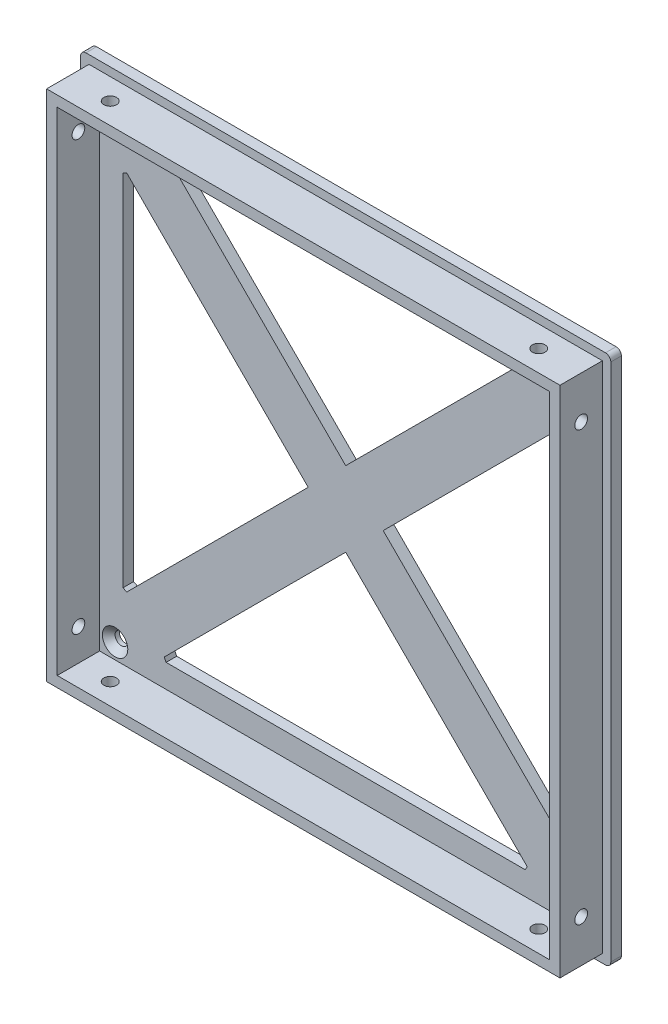
from build123d import *

# Parameters (mm, degrees)
SKETCH1_W                                       = 100
SKETCH1_H                                       = 100
BOSS_EXTRUDE1_DEPTH                             = 2
SKETCH2_W                                       = 96.825
SKETCH2_H                                       = 96.825
SKETCH2_W_2                                     = 92.825
SKETCH2_H_2                                     = 92.825
BOSS_EXTRUDE2_DEPTH                             = 8
CSK_FOR_M2_FLAT_HEAD_MACHINE_SCREW1_D           = 2.4
CSK_FOR_M2_FLAT_HEAD_MACHINE_SCREW1_DEPTH       = 311.5
CSK_FOR_M2_FLAT_HEAD_MACHINE_SCREW1_CSINK_D     = 4.8
CSK_FOR_M2_FLAT_HEAD_MACHINE_SCREW1_CSINK_ANGLE = 90
CSK_FOR_M2_FLAT_HEAD_MACHINE_SCREW1_TIP         = 0.721032743
FILLET1_R                                       = 1
M2_CLEARANCE_HOLE1_D                            = 2.4
M2_CLEARANCE_HOLE2_D                            = 2.4


with BuildPart() as part:
    # Sketch1 → Boss-Extrude1 (new body)
    with BuildSketch(Plane.XY):
        with Locations((50, 50)):
            Rectangle(SKETCH1_W, SKETCH1_H)
        with BuildLine():
            Line((8, 16.124515497), (8, 83.875484503))
            ThreePointArc((8, 83.875484503), (8.347704775, 84.052717317), (8.691485355, 84.237446833))
            Line((8.691485355, 84.237446833), (42.928932188, 50))
            Line((42.928932188, 50), (8.691485355, 15.762553167))
            ThreePointArc((8.691485355, 15.762553167), (8.347704775, 15.947282683), (8, 16.124515497))
        make_face(mode=Mode.SUBTRACT)
        with BuildLine():
            Line((16.124515497, 92), (83.875484503, 92))
            ThreePointArc((83.875484503, 92), (84.052717317, 91.652295225), (84.237446833, 91.308514645))
            Line((84.237446833, 91.308514645), (50, 57.071067812))
            Line((50, 57.071067812), (15.762553167, 91.308514645))
            ThreePointArc((15.762553167, 91.308514645), (15.947282683, 91.652295225), (16.124515497, 92))
        make_face(mode=Mode.SUBTRACT)
        with BuildLine():
            Line((92, 83.875484503), (92, 16.124515497))
            ThreePointArc((92, 16.124515497), (91.652295225, 15.947282683), (91.308514645, 15.762553167))
            Line((91.308514645, 15.762553167), (57.071067812, 50))
            Line((57.071067812, 50), (91.308514645, 84.237446833))
            ThreePointArc((91.308514645, 84.237446833), (91.652295225, 84.052717317), (92, 83.875484503))
        make_face(mode=Mode.SUBTRACT)
        with BuildLine():
            Line((16.124515497, 8), (83.875484503, 8))
            ThreePointArc((83.875484503, 8), (84.052717317, 8.347704775), (84.237446833, 8.691485355))
            Line((84.237446833, 8.691485355), (50, 42.928932188))
            Line((50, 42.928932188), (15.762553167, 8.691485355))
            ThreePointArc((15.762553167, 8.691485355), (15.947282683, 8.347704775), (16.124515497, 8))
        make_face(mode=Mode.SUBTRACT)
    extrude(amount=BOSS_EXTRUDE1_DEPTH)

    # Sketch2 → Boss-Extrude2 (add)
    with BuildSketch(Plane.XY.offset(2)):
        with Locations((50, 50)):
            Rectangle(SKETCH2_W, SKETCH2_H)
        with Locations((50, 50)):
            Rectangle(SKETCH2_W_2, SKETCH2_H_2, mode=Mode.SUBTRACT)
    extrude(amount=BOSS_EXTRUDE2_DEPTH)

    # CSK for M2 Flat Head Machine Screw1
    with Locations(Plane.XY.offset(2)):
        with Locations((6.5, 93.5), (93.5, 93.5), (93.5, 6.5), (6.5, 6.5)):
            CounterSinkHole(CSK_FOR_M2_FLAT_HEAD_MACHINE_SCREW1_D / 2, CSK_FOR_M2_FLAT_HEAD_MACHINE_SCREW1_CSINK_D / 2, depth=CSK_FOR_M2_FLAT_HEAD_MACHINE_SCREW1_DEPTH, counter_sink_angle=CSK_FOR_M2_FLAT_HEAD_MACHINE_SCREW1_CSINK_ANGLE)
            with Locations((0, 0, -(CSK_FOR_M2_FLAT_HEAD_MACHINE_SCREW1_DEPTH + CSK_FOR_M2_FLAT_HEAD_MACHINE_SCREW1_TIP / 2))):  # 118° drill point
                Cone(0, CSK_FOR_M2_FLAT_HEAD_MACHINE_SCREW1_D / 2, CSK_FOR_M2_FLAT_HEAD_MACHINE_SCREW1_TIP, mode=Mode.SUBTRACT)

    # Fillet1
    fillet1_edges = [part.edges().sort_by_distance(p)[0] for p in [
        (0, 100, 1),
        (100, 100, 1),
        (100, 0, 1),
        (0, 0, 1),
    ]]
    fillet(fillet1_edges, radius=FILLET1_R)

    # M2 Clearance Hole1 (through all)
    with Locations(Plane.ZY.offset(-1.5875)):
        with Locations((6, 90.4125), (6, 9.5875)):
            Hole(M2_CLEARANCE_HOLE1_D / 2)

    # M2 Clearance Hole2 (through all)
    with Locations(Plane(origin=(0, 98.4125, 0), x_dir=(1, 0, 0), z_dir=(0, 1, 0))):
        with Locations((9.5875, -6), (90.4125, -6)):
            Hole(M2_CLEARANCE_HOLE2_D / 2)


solid = part.part
